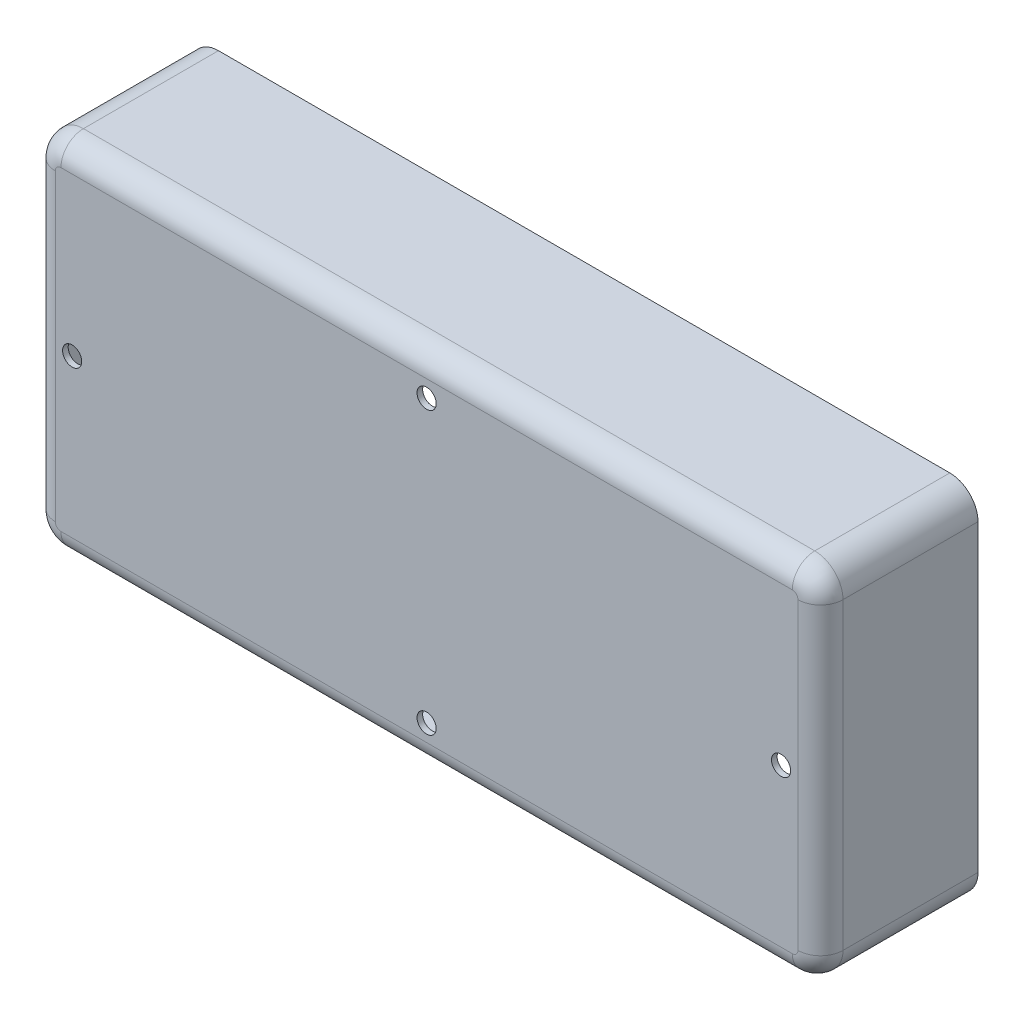
from build123d import *

# Parameters (mm, degrees)
BOSS_EXTRUDE1_DEPTH = 44.45
FILLET1_R           = 6.35
SHELL1_T            = -1.5875
CUT_EXTRUDE1_REACH  = 132.02
SKETCH2_R           = 2.7051


with BuildPart() as part:
    # Sketch1 → Boss-Extrude1 (new body)
    with BuildSketch(Plane.XY):
        with BuildLine():
            Line((-103.1748, 50.8), (103.1748, 50.8))
            ThreePointArc((103.1748, 50.8), (108.796440332, 48.471440332), (111.125, 42.8498))
            Line((111.125, 42.8498), (111.125, -42.8498))
            ThreePointArc((111.125, -42.8498), (108.796440332, -48.471440332), (103.1748, -50.8))
            Line((103.1748, -50.8), (-103.1748, -50.8))
            ThreePointArc((-103.1748, -50.8), (-108.796440332, -48.471440332), (-111.125, -42.8498))
            Line((-111.125, -42.8498), (-111.125, 42.8498))
            ThreePointArc((-111.125, 42.8498), (-108.796440332, 48.471440332), (-103.1748, 50.8))
        make_face()
    extrude(amount=BOSS_EXTRUDE1_DEPTH)

    # Fillet1
    fillet1_edges = [part.edges().sort_by_distance(p)[0] for p in [
        (108.796440332, -48.471440332, 44.45),
        (111.125, 0, 44.45),
        (108.796440332, 48.471440332, 44.45),
        (0, 50.8, 44.45),
        (-108.796440332, 48.471440332, 44.45),
        (-111.125, 0, 44.45),
        (-108.796440332, -48.471440332, 44.45),
        (0, -50.8, 44.45),
    ]]
    fillet(fillet1_edges, radius=FILLET1_R)

    # Shell1
    shell1_openings = [part.faces().sort_by_distance(p)[0] for p in [
        (0, 0, 0),
    ]]
    offset(amount=SHELL1_T, openings=shell1_openings, kind=Kind.INTERSECTION)

    # Sketch2 → Cut-Extrude1 (cut, up to next)
    with BuildSketch(Plane.XY.offset(44.45), mode=Mode.PRIVATE) as cut_extrude1_sk1:
        with Locations((0, 39.6875)):
            Circle(SKETCH2_R)
    cut_extrude1_tool1 = extrude(cut_extrude1_sk1.sketch, amount=-CUT_EXTRUDE1_REACH, mode=Mode.PRIVATE) & part.part
    # Sketch2 → Cut-Extrude1 (cut, up to next)
    with BuildSketch(Plane.XY.offset(44.45), mode=Mode.PRIVATE) as cut_extrude1_sk2:
        with Locations((0, -39.6875)):
            Circle(SKETCH2_R)
    cut_extrude1_tool2 = extrude(cut_extrude1_sk2.sketch, amount=-CUT_EXTRUDE1_REACH, mode=Mode.PRIVATE) & part.part
    # Sketch2 → Cut-Extrude1 (cut, up to next)
    with BuildSketch(Plane.XY.offset(44.45), mode=Mode.PRIVATE) as cut_extrude1_sk3:
        with Locations((100.0125, 0)):
            Circle(SKETCH2_R)
    cut_extrude1_tool3 = extrude(cut_extrude1_sk3.sketch, amount=-CUT_EXTRUDE1_REACH, mode=Mode.PRIVATE) & part.part
    # Sketch2 → Cut-Extrude1 (cut, up to next)
    with BuildSketch(Plane.XY.offset(44.45), mode=Mode.PRIVATE) as cut_extrude1_sk4:
        with Locations((-100.0125, 0)):
            Circle(SKETCH2_R)
    cut_extrude1_tool4 = extrude(cut_extrude1_sk4.sketch, amount=-CUT_EXTRUDE1_REACH, mode=Mode.PRIVATE) & part.part
    add(cut_extrude1_tool1.solids().sort_by_distance((0, 39.6875, 44.45))[0], mode=Mode.SUBTRACT)
    add(cut_extrude1_tool2.solids().sort_by_distance((0, -39.6875, 44.45))[0], mode=Mode.SUBTRACT)
    add(cut_extrude1_tool3.solids().sort_by_distance((100.0125, 0, 44.45))[0], mode=Mode.SUBTRACT)
    add(cut_extrude1_tool4.solids().sort_by_distance((-100.0125, 0, 44.45))[0], mode=Mode.SUBTRACT)


solid = part.part
